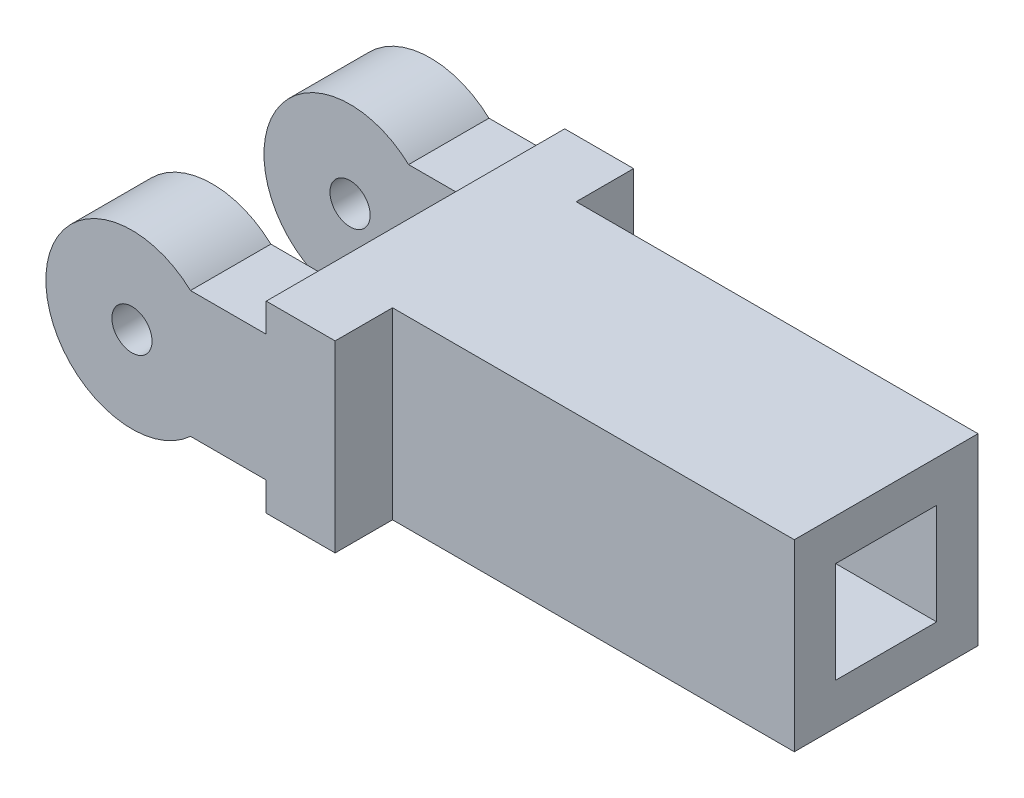
from build123d import *

# Parameters (mm, degrees)
SKETCH_1_W               = 3.2
SKETCH_1_H               = 3.2
SKETCH_1_W_2             = 1.76
SKETCH_1_H_2             = 1.76
EXTRUDE_1_DEPTH          = 7
SKETCH_2_W               = 3.2
SKETCH_2_H               = 3.2
EXTRUDE_2_DEPTH          = 1.2
EXTRUDE_3_DEPTH          = 2.6
CUT_EXTRUDE_1_DEPTH      = 1.2
SKETCH_5_W               = 5.2
SKETCH_5_H               = 3.2
EXTRUDE_4_DEPTH          = 1.2
CUT_EXTRUDE_2_DEPTH      = 9.124038405
CUT_EXTRUDE_2_DEPTH_BACK = 9.124038405
SKETCH_6_R               = 0.35


with BuildPart() as part:
    # 草图1 → 凸台-拉伸1 (new body)
    with BuildSketch(Plane(origin=(0, 0, 0), x_dir=(0, 0, -1), z_dir=(1, 0, 0))):
        Rectangle(SKETCH_1_W, SKETCH_1_H)
        Rectangle(SKETCH_1_W_2, SKETCH_1_H_2, mode=Mode.SUBTRACT)
    extrude(amount=EXTRUDE_1_DEPTH)

    # 草图2 → 凸台-拉伸2 (add)
    with BuildSketch(Plane.ZY):
        Rectangle(SKETCH_2_W, SKETCH_2_H)
    extrude(amount=EXTRUDE_2_DEPTH)

    # 草图3 → 凸台-拉伸3 (add, symmetric)
    with BuildSketch(Plane.XY):
        with BuildLine():
            Line((-1.2, -1.1), (-1.2, 1.1))
            Line((-1.2, 1.1), (-2.52, 1.1))
            ThreePointArc((-2.52, 1.1), (-2.165084685, 0.600122548), (-2.039803903, 0))
            ThreePointArc((-2.039803903, 0), (-2.165084685, -0.600122548), (-2.52, -1.1))
            Line((-2.52, -1.1), (-1.2, -1.1))
        make_face()
        with BuildLine():
            ThreePointArc((-2.039803903, 0), (-2.165084685, 0.600122548), (-2.52, 1.1))
            Line((-2.52, 1.1), (-2.52, -1.1))
            ThreePointArc((-2.52, -1.1), (-2.165084685, -0.600122548), (-2.039803903, 0))
        make_face()
        with BuildLine():
            Line((-2.52, -1.1), (-2.52, 1.1))
            ThreePointArc((-2.52, 1.1), (-5.039803903, 0), (-2.52, -1.1))
        make_face()
        with BuildLine():
            ThreePointArc((-2.039803903, 0), (-2.165084685, 0.600122548), (-2.52, 1.1))
            Line((-2.52, 1.1), (-2.52, -1.1))
            ThreePointArc((-2.52, -1.1), (-2.165084685, -0.600122548), (-2.039803903, 0))
        make_face()
        with BuildLine():
            Line((-2.52, -1.1), (-2.52, 1.1))
            ThreePointArc((-2.52, 1.1), (-5.039803903, 0), (-2.52, -1.1))
        make_face()
    extrude(amount=EXTRUDE_3_DEPTH, both=True)

    # 草图4 → 切除-拉伸1 (cut, symmetric)
    with BuildSketch(Plane.XY):
        with BuildLine():
            Line((-1.2, 1.1), (-2.52, 1.1))
            ThreePointArc((-2.52, 1.1), (-5.039803903, 0), (-2.52, -1.1))
            Line((-2.52, -1.1), (-1.2, -1.1))
            Line((-1.2, -1.1), (-1.2, 1.1))
        make_face()
    extrude(amount=CUT_EXTRUDE_1_DEPTH, both=True, mode=Mode.SUBTRACT)

    # 草图5 → 凸台-拉伸4 (add)
    with BuildSketch(Plane(origin=(-1.2, 0, 0), x_dir=(0, 0, -1), z_dir=(1, 0, 0))):
        Rectangle(SKETCH_5_W, SKETCH_5_H)
    extrude(amount=EXTRUDE_4_DEPTH)

    # 草图6 → 切除-拉伸2 (cut, two sides: drawn at the far end of the back side and taken through both)
    with BuildSketch(Plane(origin=(0, 0, 1.2), x_dir=(-1, 0, 0), z_dir=(0, 0, -1)).offset(-CUT_EXTRUDE_2_DEPTH_BACK)):
        with Locations((3.539803903, 0)):
            Circle(SKETCH_6_R)
    extrude(amount=CUT_EXTRUDE_2_DEPTH + CUT_EXTRUDE_2_DEPTH_BACK, mode=Mode.SUBTRACT)


solid = part.part
